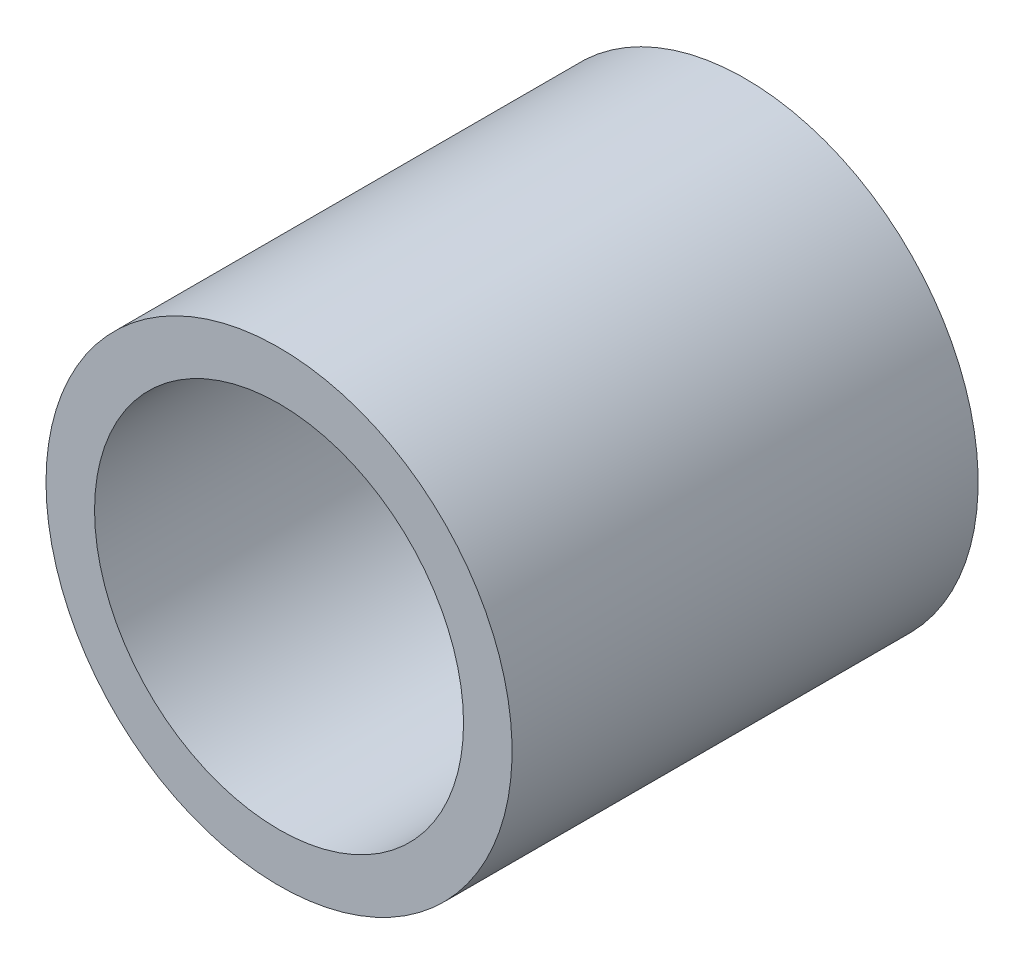
from build123d import *

# Parameters (mm, degrees)
SKETCH1_R           = 9.525
SKETCH1_R_2         = 7.540625
BOSS_EXTRUDE1_DEPTH = 9.525


with BuildPart() as part:
    # Sketch1 → Boss-Extrude1 (new, symmetric)
    with BuildSketch(Plane.XY):
        with Locations(Location((0, 0, 0), (0, 0, 180))):
            Circle(SKETCH1_R)
        with Locations(Location((0, 0, 0), (0, 0, 180))):
            Circle(SKETCH1_R_2, mode=Mode.SUBTRACT)
    extrude(amount=BOSS_EXTRUDE1_DEPTH, both=True)


solid = part.part
